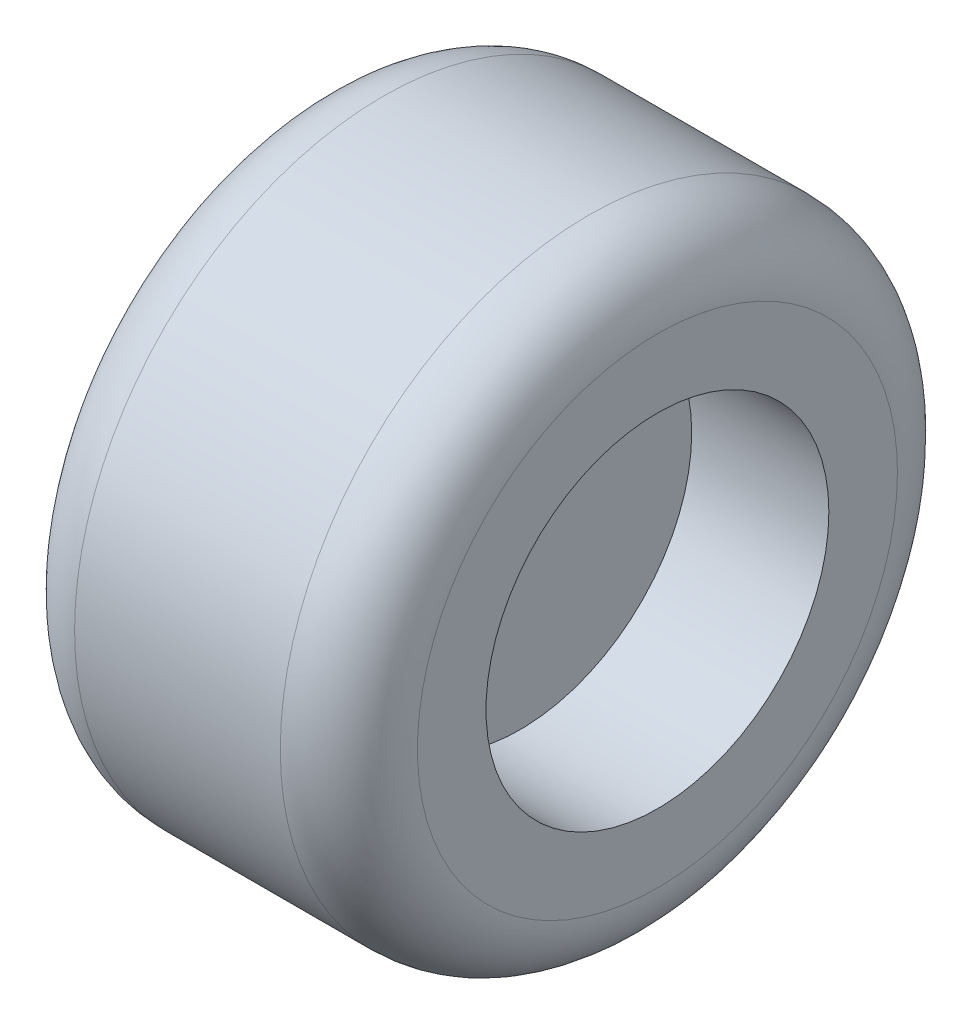
from build123d import *

# Parameters (mm, degrees)
SKETCH1_R           = 22.5
BOSS_EXTRUDE1_DEPTH = 25
SKETCH2_R           = 12.5
CUT_EXTRUDE1_DEPTH  = 10
FILLET1_R           = 5
SKETCH3_R           = 1.5
CUT_EXTRUDE2_DEPTH  = 41.466035196


with BuildPart() as part:
    # Sketch1 → Boss-Extrude1 (new body)
    with BuildSketch(Plane(origin=(0, 0, 0), x_dir=(0, 0, -1), z_dir=(1, 0, 0))):
        Circle(SKETCH1_R)
    extrude(amount=BOSS_EXTRUDE1_DEPTH)

    # Sketch2 → Cut-Extrude1 (cut)
    with BuildSketch(Plane(origin=(25, 0, 0), x_dir=(0, 0, -1), z_dir=(1, 0, 0))):
        Circle(SKETCH2_R)
    extrude(amount=-CUT_EXTRUDE1_DEPTH, mode=Mode.SUBTRACT)

    # Fillet1
    fillet1_edges = [part.edges().sort_by_distance(p)[0] for p in [
        (0, 0, 22.5),
        (25, 0, 22.5),
    ]]
    fillet(fillet1_edges, radius=FILLET1_R)

    # Sketch3 → Cut-Extrude2 (cut, through all)
    with BuildSketch(Plane.ZY):
        Circle(SKETCH3_R)
    extrude(amount=-CUT_EXTRUDE2_DEPTH, mode=Mode.SUBTRACT)


solid = part.part
